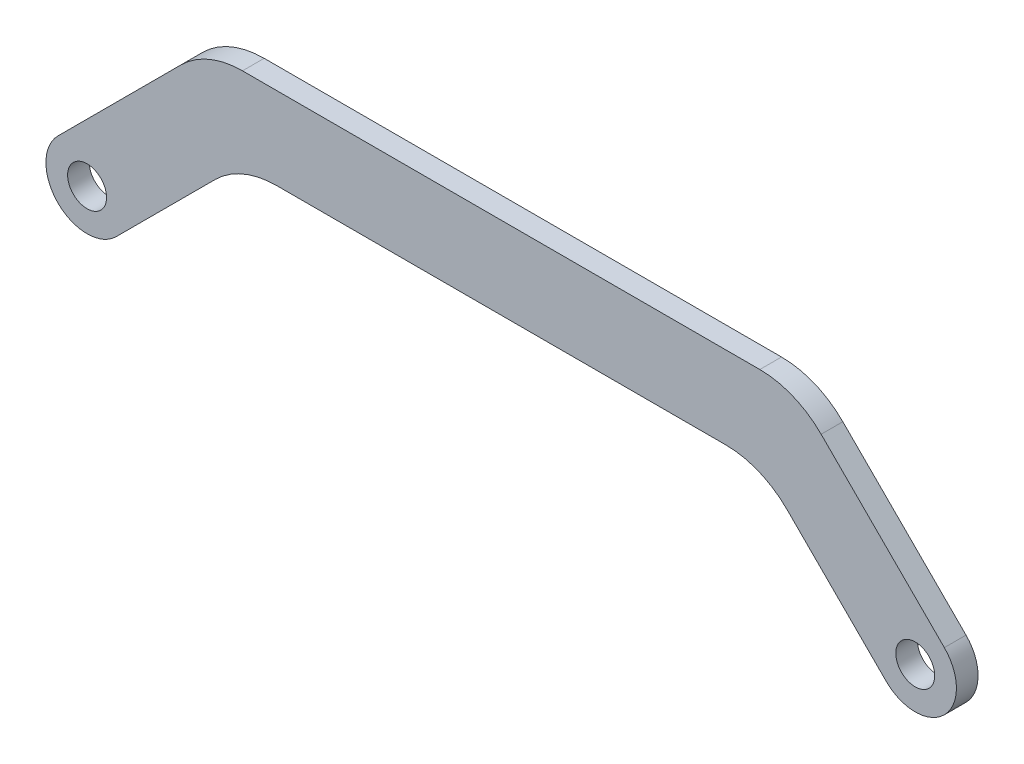
from build123d import *

# Parameters (mm, degrees)
SKETCH1_R           = 4.49
BOSS_EXTRUDE1_DEPTH = 5
FILLET1_R           = 20
FILLET2_R           = 20
FILLET3_R           = 20
FILLET4_R           = 20


with BuildPart() as part:
    # Sketch1 → Boss-Extrude1 (new body)
    with BuildSketch(Plane.XY):
        with BuildLine():
            Line((-6.710443353, 6.710443353), (27.559113293, 40.98))
            Line((27.559113293, 40.98), (163.440886707, 40.98))
            Line((163.440886707, 40.98), (197.710443353, 6.710443353))
            ThreePointArc((197.710443353, 6.710443353), (197.710443353, -6.710443353), (184.289556647, -6.710443353))
            Line((184.289556647, -6.710443353), (155.579113293, 22))
            Line((155.579113293, 22), (35.420886707, 22))
            Line((35.420886707, 22), (6.710443353, -6.710443353))
            ThreePointArc((6.710443353, -6.710443353), (-6.710443353, -6.710443353), (-6.710443353, 6.710443353))
        make_face()
        Circle(SKETCH1_R, mode=Mode.SUBTRACT)
        with Locations((191, 0)):
            Circle(SKETCH1_R, mode=Mode.SUBTRACT)
    extrude(amount=BOSS_EXTRUDE1_DEPTH)

    # Fillet1
    fillet1_edges = [part.edges().sort_by_distance(p)[0] for p in [
        (27.559113293, 40.98, 2.5),
    ]]
    fillet(fillet1_edges, radius=FILLET1_R)

    # Fillet2
    fillet2_edges = [part.edges().sort_by_distance(p)[0] for p in [
        (35.420886707, 22, 2.5),
    ]]
    fillet(fillet2_edges, radius=FILLET2_R)

    # Fillet3
    fillet3_edges = [part.edges().sort_by_distance(p)[0] for p in [
        (163.440886707, 40.98, 2.5),
    ]]
    fillet(fillet3_edges, radius=FILLET3_R)

    # Fillet4
    fillet4_edges = [part.edges().sort_by_distance(p)[0] for p in [
        (155.579113293, 22, 2.5),
    ]]
    fillet(fillet4_edges, radius=FILLET4_R)


solid = part.part
